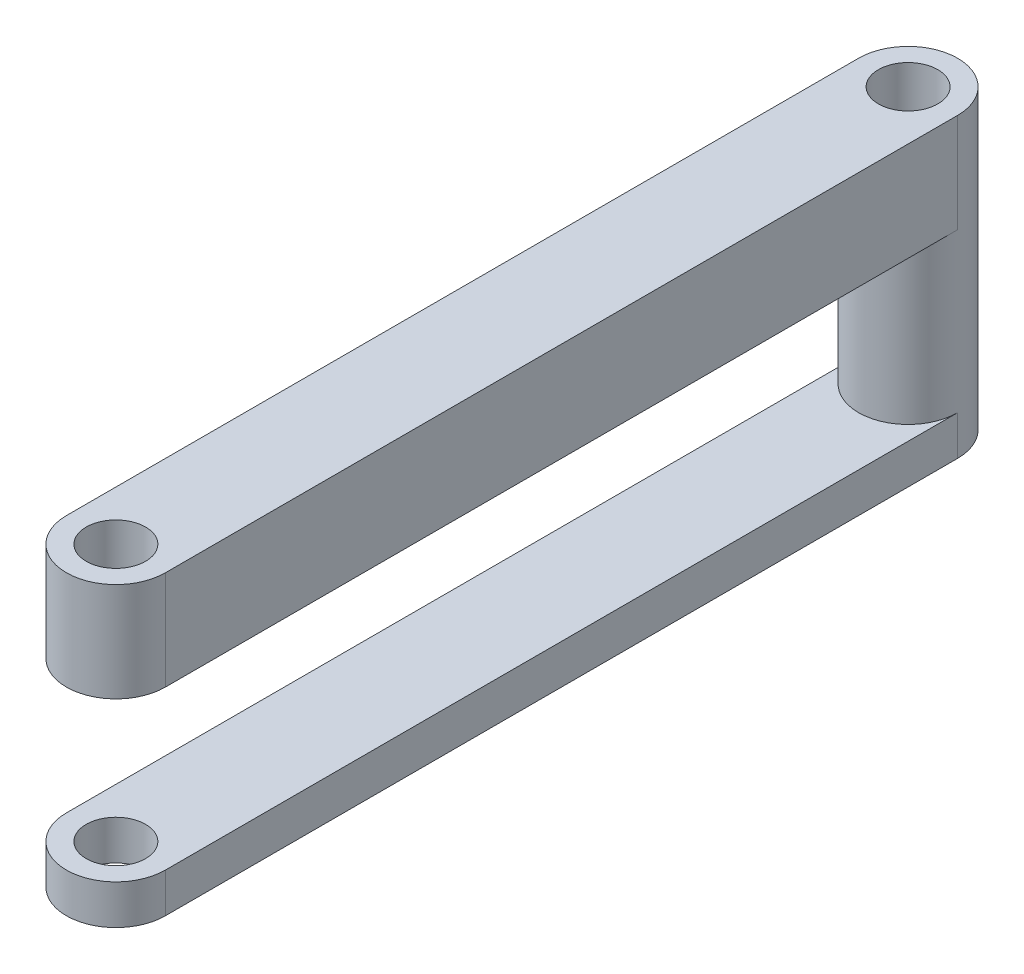
from build123d import *
from build123d.topology import SkipClean

# Parameters (mm, degrees)
BOSS_EXTRUDE1_DEPTH             = 2
SKETCH2_R                       = 2.5
BOSS_EXTRUDE2_DEPTH             = 12
BOSS_EXTRUDE3_START             = 10
BOSS_EXTRUDE3_DEPTH             = 5
F_3_0MM_CLEARANCE_DOWEL_HOLE1_D = 3


with BuildPart() as part:
    # Sketch1 → Boss-Extrude1 (new body)
    with BuildSketch(Plane(origin=(0, 0, 0), x_dir=(1, 0, 0), z_dir=(0, 1, 0))):
        with BuildLine():
            Line((2.5, 0), (2.5, -40))
            ThreePointArc((2.5, -40), (0, -42.5), (-2.5, -40))
            Line((-2.5, -40), (-2.5, 0))
            ThreePointArc((-2.5, 0), (0, 2.5), (2.5, 0))
        make_face()
    extrude(amount=BOSS_EXTRUDE1_DEPTH)

    # Sketch2 → Boss-Extrude2 (add)
    with SkipClean():  # the faces are left unmerged after this step: merging them gives an invalid solid
        with BuildSketch(Plane(origin=(0, 2, 0), x_dir=(1, 0, 0), z_dir=(0, 1, 0))):
            Circle(SKETCH2_R)
        extrude(amount=BOSS_EXTRUDE2_DEPTH)
    add(part.part.scale(1), mode=Mode.REPLACE)  # the faces are merged on a copy

    # Sketch1<3> → Boss-Extrude3 (add)
    with BuildSketch(Plane(origin=(0, 0, 0), x_dir=(1, 0, 0), z_dir=(0, 1, 0)).offset(BOSS_EXTRUDE3_START)):
        with BuildLine():
            Line((2.5, 0), (2.5, -40))
            ThreePointArc((2.5, -40), (0, -42.5), (-2.5, -40))
            Line((-2.5, -40), (-2.5, 0))
            ThreePointArc((-2.5, 0), (0, 2.5), (2.5, 0))
        make_face()
    extrude(amount=BOSS_EXTRUDE3_DEPTH)

    # Ø3.0mm Clearance Dowel Hole1 (through all)
    with Locations(Plane(origin=(0, 15, 0), x_dir=(1, 0, 0), z_dir=(0, 1, 0))):
        with Locations((0, 0), (0, -40)):
            Hole(F_3_0MM_CLEARANCE_DOWEL_HOLE1_D / 2)


solid = part.part
